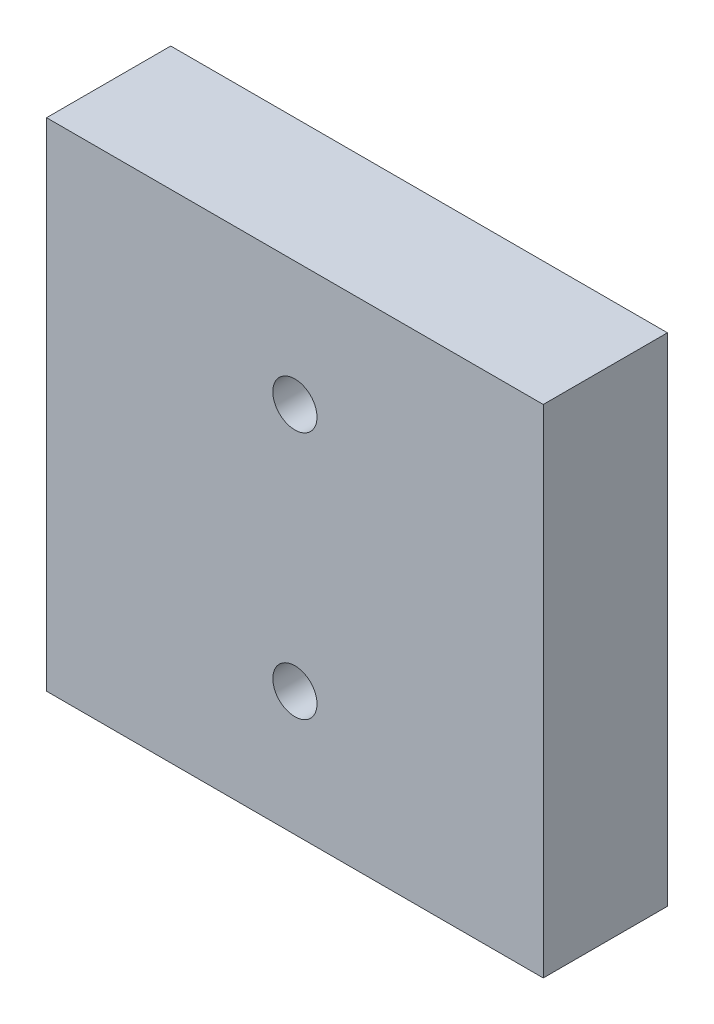
from build123d import *

# Parameters (mm, degrees)
SKETCH1_W                   = 25.4
SKETCH1_H                   = 25.4
BOSS_EXTRUDE1_DEPTH         = 6.35
F_43_0_089_DIAMETER_HOLE1_D = 2.2606


with BuildPart() as part:
    # Sketch1 → Boss-Extrude1 (new body)
    with BuildSketch(Plane.XY):
        with Locations((12.7, 12.7)):
            Rectangle(SKETCH1_W, SKETCH1_H)
    extrude(amount=BOSS_EXTRUDE1_DEPTH)

    # #43 (0.089) Diameter Hole1 (through all)
    with Locations(Plane(origin=(0, 0, 0), x_dir=(-1, 0, 0), z_dir=(0, 0, -1))):
        with Locations((-12.7, 6.35), (-12.7, 19.05)):
            Hole(F_43_0_089_DIAMETER_HOLE1_D / 2)


solid = part.part
